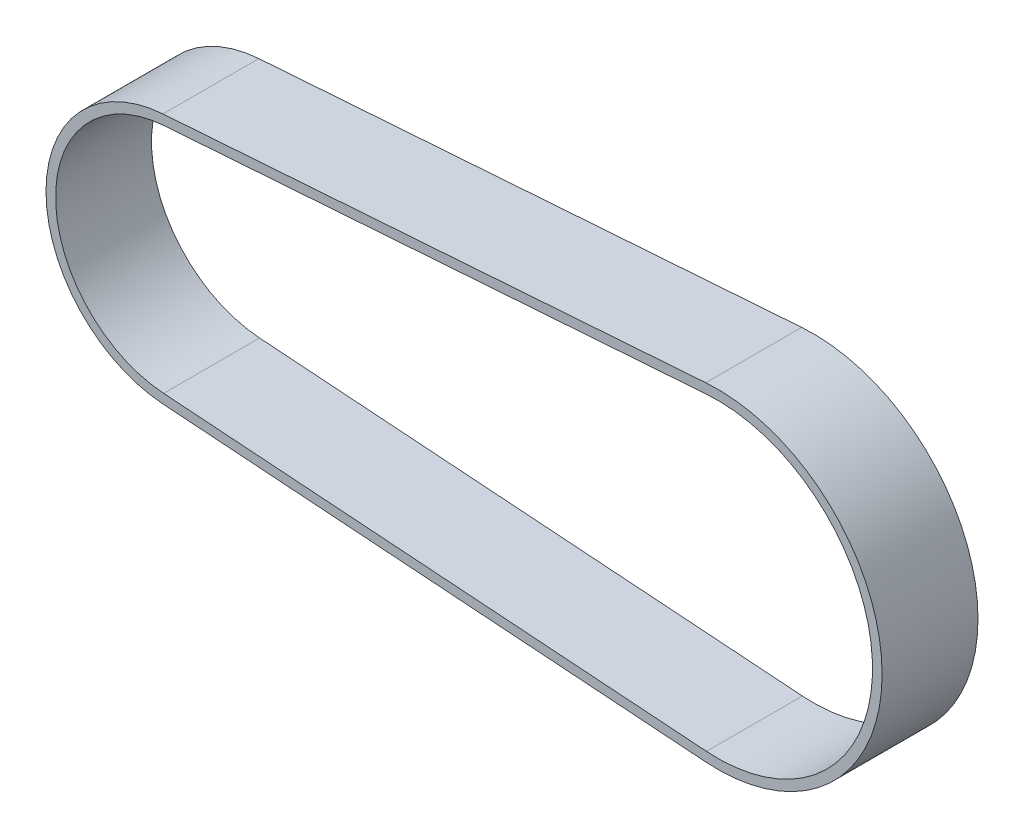
from build123d import *

# Parameters (mm, degrees)
EXTRU_MINCE1_DEPTH = 5


with BuildPart() as part:
    # Esquisse1 → Extru.-Mince1 (new, symmetric)
    with BuildSketch(Plane.XY):
        with BuildLine():
            Line((-0.932357603, 13.096854939), (55.674384043, 17.126656459))
            ThreePointArc((55.674384043, 17.126656459), (74.063620908, 0), (55.674384043, -17.126656459))
            Line((55.674384043, -17.126656459), (-0.932357603, -13.096854939))
            ThreePointArc((-0.932357603, -13.096854939), (-13.13, 0), (-0.932357603, 13.096854939))
        make_face()
        with BuildLine():
            Line((-0.861347884, 12.099379316), (55.745393761, 16.129180835))
            ThreePointArc((55.745393761, 16.129180835), (73.063620908, 0), (55.745393761, -16.129180835))
            Line((55.745393761, -16.129180835), (-0.861347884, -12.099379316))
            ThreePointArc((-0.861347884, -12.099379316), (-12.13, 0), (-0.861347884, 12.099379316))
        make_face(mode=Mode.SUBTRACT)
    extrude(amount=EXTRU_MINCE1_DEPTH, both=True)


solid = part.part
